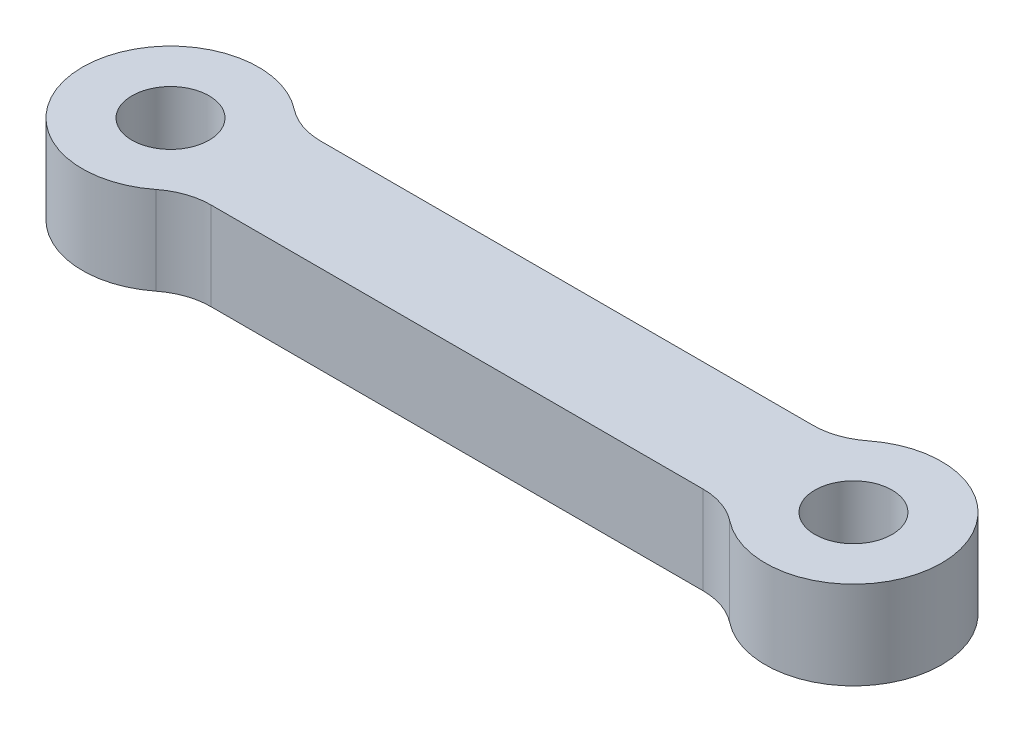
from build123d import *

# Parameters (mm, degrees)
SKETCH1_R           = 1.75
BOSS_EXTRUDE1_DEPTH = 4
FILLET1_R           = 3


with BuildPart() as part:
    # Sketch1 → Boss-Extrude1 (new body)
    with BuildSketch(Plane(origin=(0, 0, 0), x_dir=(1, 0, 0), z_dir=(0, 1, 0))):
        with BuildLine():
            Line((27.877501001, 2.5), (3.122498999, 2.5))
            ThreePointArc((3.122498999, 2.5), (-4, 0), (3.122498999, -2.5))
            Line((3.122498999, -2.5), (27.877501001, -2.5))
            ThreePointArc((27.877501001, -2.5), (35, 0), (27.877501001, 2.5))
        make_face()
        with Locations(Location((0, 0, 0), (0, 0, 270))):
            Circle(SKETCH1_R, mode=Mode.SUBTRACT)
        with Locations(Location((31, 0, 0), (0, 0, 270))):
            Circle(SKETCH1_R, mode=Mode.SUBTRACT)
    extrude(amount=BOSS_EXTRUDE1_DEPTH)

    # Fillet1
    fillet1_edges = [part.edges().sort_by_distance(p)[0] for p in [
        (3.122498999, 2, -2.5),
        (27.877501001, 2, -2.5),
        (27.877501001, 2, 2.5),
        (3.122498999, 2, 2.5),
    ]]
    fillet(fillet1_edges, radius=FILLET1_R)


solid = part.part
